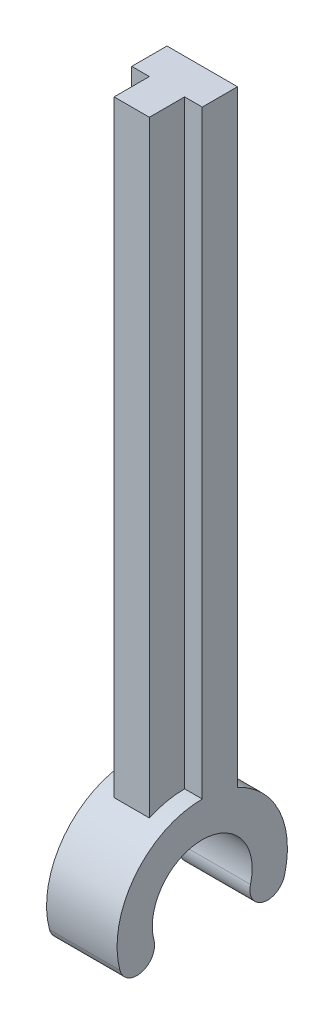
from build123d import *

# Parameters (mm, degrees)
BOSS_EXTRUDE1_DEPTH      = 3
BOSS_EXTRUDE1_DEPTH_BACK = 3
BOSS_EXTRUDE2_DEPTH      = 3
BOSS_EXTRUDE2_DEPTH_BACK = 3
BOSS_EXTRUDE3_DEPTH      = 1.5
BOSS_EXTRUDE3_DEPTH_BACK = 1.5
SKETCH3_W                = 3
SKETCH3_H                = 52


with BuildPart() as part:
    # Sketch1 → Boss-Extrude1 (new, two sides: drawn at the far end of the back side and taken through both)
    with BuildSketch(Plane(origin=(0, 0, 0), x_dir=(0, 0, -1), z_dir=(1, 0, 0)).offset(-BOSS_EXTRUDE1_DEPTH_BACK)):
        with BuildLine():
            ThreePointArc((-4.105184762, -1.099980942), (0, 4.25), (4.105184762, -1.099980942))
            ThreePointArc((4.105184762, -1.099980942), (5.165844934, -2.937098249), (7.002962241, -1.876438077))
            ThreePointArc((7.002962241, -1.876438077), (0, 7.25), (-7.002962241, -1.876438077))
            ThreePointArc((-7.002962241, -1.876438077), (-5.165844934, -2.937098249), (-4.105184762, -1.099980942))
        make_face()
    extrude(amount=BOSS_EXTRUDE1_DEPTH + BOSS_EXTRUDE1_DEPTH_BACK)

    # Sketch2 → Boss-Extrude2 (add, two sides: drawn at the far end of the back side and taken through both)
    with BuildSketch(Plane(origin=(0, 0, 0), x_dir=(0, 0, -1), z_dir=(1, 0, 0)).offset(-BOSS_EXTRUDE2_DEPTH_BACK)):
        Polygon((0, 7.25), (0, 5.25), (3, 5.25), (3, 58.25), (0, 58.25), align=None)
    extrude(amount=BOSS_EXTRUDE2_DEPTH + BOSS_EXTRUDE2_DEPTH_BACK)

    # Sketch3 → Boss-Extrude3 (add, two sides: drawn at the far end of the back side and taken through both)
    with BuildSketch(Plane(origin=(0, 0, 0), x_dir=(0, 0, -1), z_dir=(1, 0, 0)).offset(-BOSS_EXTRUDE3_DEPTH_BACK)):
        with Locations((-1.5, 32.25)):
            Rectangle(SKETCH3_W, SKETCH3_H)
    extrude(amount=BOSS_EXTRUDE3_DEPTH + BOSS_EXTRUDE3_DEPTH_BACK)


solid = part.part
